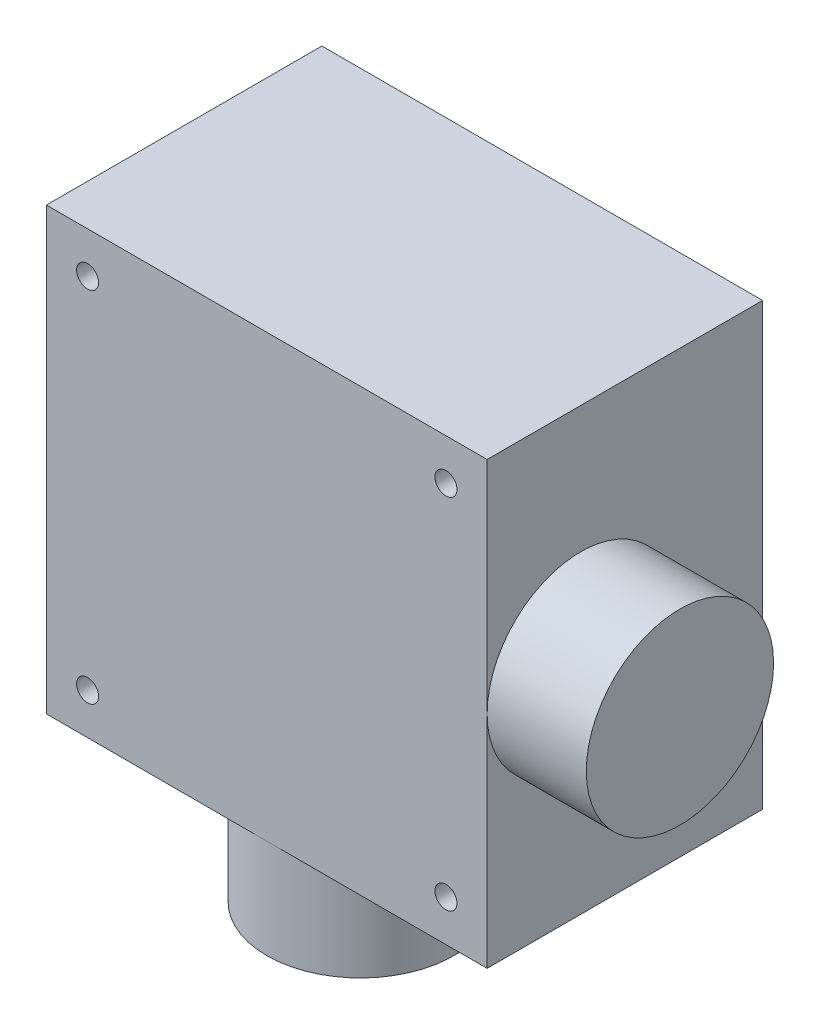
from build123d import *

# Parameters (mm, degrees)
SKETCH1_W           = 40
SKETCH1_H           = 40
BOSS_EXTRUDE1_DEPTH = 25
SKETCH2_R           = 8.5
BOSS_EXTRUDE2_DEPTH = 9
SKETCH3_R           = 1
CUT_EXTRUDE1_DEPTH  = 10


with BuildPart() as part:
    # Sketch1 → Boss-Extrude1 (new body)
    with BuildSketch(Plane.XY):
        Rectangle(SKETCH1_W, SKETCH1_H)
    extrude(amount=BOSS_EXTRUDE1_DEPTH)

    # Sketch2 → Boss-Extrude2 (add)
    with BuildSketch(Plane.XZ.offset(20)):
        with Locations((0, 16.5)):
            Circle(SKETCH2_R)
    boss_extrude2 = extrude(amount=BOSS_EXTRUDE2_DEPTH)

    # Mirror1: Boss-Extrude2 across plane
    add(boss_extrude2.mirror(Plane(origin=(0, 0, 0), x_dir=(0, 0, 1), z_dir=(0.7071067811865475, 0.7071067811865476, 0))))

    # Sketch3 → Cut-Extrude1 (cut)
    with BuildSketch(Plane.XY.offset(25)):
        with Locations((-16.263455967, 16.263455967)):
            Circle(SKETCH3_R)
        with Locations((16.263455967, 16.263455967)):
            Circle(SKETCH3_R)
        with Locations((-16.263455967, -16.263455967)):
            Circle(SKETCH3_R)
        with Locations((16.263455967, -16.263455967)):
            Circle(SKETCH3_R)
    extrude(amount=-CUT_EXTRUDE1_DEPTH, mode=Mode.SUBTRACT)


solid = part.part
